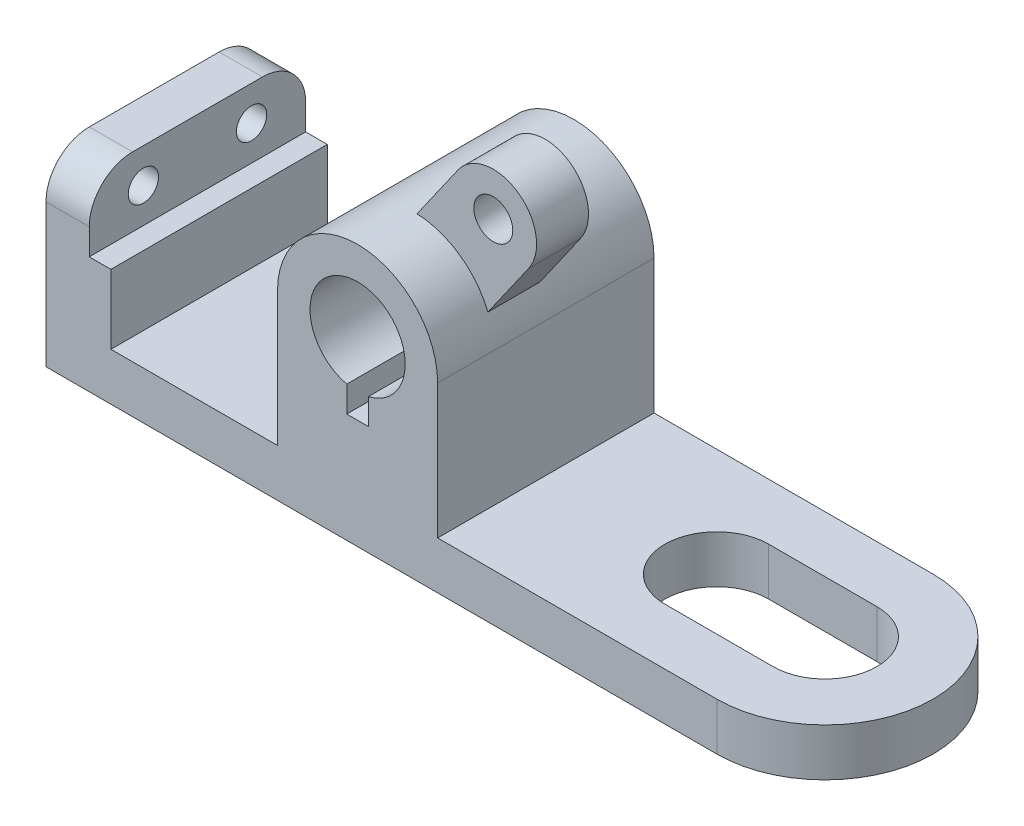
from build123d import *

# Parameters (mm, degrees)
BOSS_EXTRUDE5_DEPTH      = 25
BOSS_EXTRUDE5_DEPTH_BACK = 25
SKETCH1_6_R              = 4.5
BOSS_EXTRUDE6_DEPTH      = 12
BOSS_EXTRUDE7_DEPTH      = 11
CUT_EXTRUDE1_DEPTH       = 11
SKETCH6_R                = 3.5
CUT_EXTRUDE2_DEPTH       = 11
CUT_EXTRUDE3_DEPTH       = 11


with BuildPart() as part:
    # Sketch1 → Boss-Extrude5 (new, two sides: drawn at the far end of the back side and taken through both)
    with BuildSketch(Plane.XY.offset(-BOSS_EXTRUDE5_DEPTH_BACK)):
        with BuildLine():
            Line((0, 43), (0, 0))
            Line((0, 0), (155, 0))
            Line((155, 0), (155, 11))
            Line((155, 11), (90.5, 11))
            Line((90.5, 11), (90.5, 42))
            ThreePointArc((90.5, 42), (90.151437184, 45.574259105), (89.118883443, 49.013831311))
            ThreePointArc((89.118883443, 49.013831311), (82.611164072, 57.154312819), (72.735842557, 60.485360038))
            ThreePointArc((72.735842557, 60.485360038), (59.181323924, 55.339098307), (53.5, 42))
            Line((53.5, 42), (53.5, 11))
            Line((53.5, 11), (15, 11))
            Line((15, 11), (15, 27))
            Line((15, 27), (10, 27))
            Line((10, 27), (10, 43))
            Line((10, 43), (0, 43))
        make_face()
        with BuildLine():
            Line((69.5, 25.287857357), (69.5, 31.287857357))
            ThreePointArc((69.5, 31.287857357), (72, 53), (74.5, 31.287857357))
            Line((74.5, 31.287857357), (74.5, 25.287857357))
            Line((74.5, 25.287857357), (69.5, 25.287857357))
        make_face(mode=Mode.SUBTRACT)
    extrude(amount=BOSS_EXTRUDE5_DEPTH + BOSS_EXTRUDE5_DEPTH_BACK)

    # Sketch1<6> → Boss-Extrude6 (add)
    with BuildSketch(Plane.XY):
        with BuildLine():
            ThreePointArc((72.735842557, 60.485360038), (82.611164072, 57.154312819), (89.118883443, 49.013831311))
            Line((89.118883443, 49.013831311), (98.545966406, 62.477101054))
            ThreePointArc((98.545966406, 62.477101054), (96.090210327, 76.40438586), (82.16292552, 73.948629781))
            Line((82.16292552, 73.948629781), (72.735842557, 60.485360038))
        make_face()
        with Locations((90.354445963, 68.212865417)):
            Circle(SKETCH1_6_R, mode=Mode.SUBTRACT)
    extrude(amount=BOSS_EXTRUDE6_DEPTH)

    # Sketch4 → Boss-Extrude7 (add)
    with BuildSketch(Plane(origin=(0, 11, 0), x_dir=(1, 0, 0), z_dir=(0, 1, 0))):
        with BuildLine():
            Line((155, 25), (155, -25))
            ThreePointArc((155, -25), (180, 0), (155, 25))
        make_face()
    extrude(amount=-BOSS_EXTRUDE7_DEPTH)

    # Sketch5 → Cut-Extrude1 (cut)
    with BuildSketch(Plane(origin=(10, 0, 0), x_dir=(0, 0, -1), z_dir=(1, 0, 0))):
        with BuildLine():
            Line((25, 43), (15, 43))
            ThreePointArc((15, 43), (22.071067812, 40.071067812), (25, 33))
            Line((25, 33), (25, 43))
        make_face()
        with BuildLine():
            ThreePointArc((-25, 33), (-22.071067812, 40.071067812), (-15, 43))
            Line((-15, 43), (-25, 43))
            Line((-25, 43), (-25, 33))
        make_face()
    extrude(amount=-CUT_EXTRUDE1_DEPTH, mode=Mode.SUBTRACT)

    # Sketch6 → Cut-Extrude2 (cut)
    with BuildSketch(Plane(origin=(10, 0, 0), x_dir=(0, 0, -1), z_dir=(1, 0, 0))):
        with Locations((-12.5, 35)):
            Circle(SKETCH6_R)
        with Locations((12.5, 35)):
            Circle(SKETCH6_R)
    extrude(amount=-CUT_EXTRUDE2_DEPTH, mode=Mode.SUBTRACT)

    # Sketch7 → Cut-Extrude3 (cut)
    with BuildSketch(Plane(origin=(0, 11, 0), x_dir=(1, 0, 0), z_dir=(0, 1, 0))):
        with BuildLine():
            Line((130, -12), (155, -12))
            ThreePointArc((155, -12), (167, 0), (155, 12))
            Line((155, 12), (130, 12))
            ThreePointArc((130, 12), (118, 0), (130, -12))
        make_face()
    extrude(amount=-CUT_EXTRUDE3_DEPTH, mode=Mode.SUBTRACT)


solid = part.part
